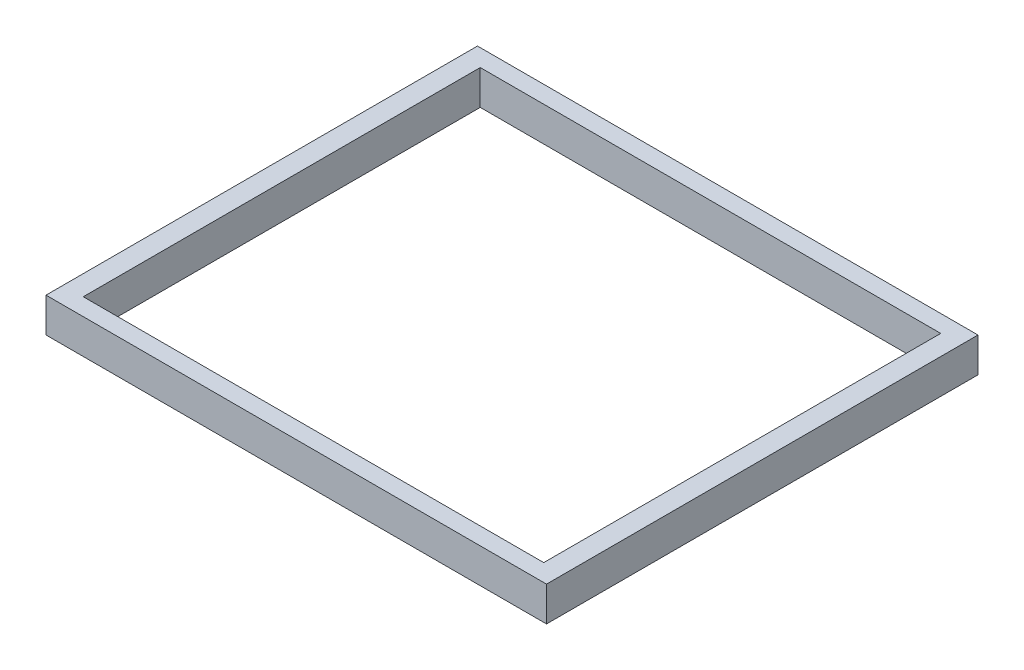
from build123d import *

# Parameters (mm, degrees)
SKETCH1_W           = 736.6
SKETCH1_H           = 635
SKETCH1_W_2         = 677.672
SKETCH1_H_2         = 584.2
BOSS_EXTRUDE2_DEPTH = 50.8


with BuildPart() as part:
    # Sketch1 → Boss-Extrude2 (new body)
    with BuildSketch(Plane(origin=(0, 0, 0), x_dir=(1, 0, 0), z_dir=(0, 1, 0))):
        Rectangle(SKETCH1_W, SKETCH1_H)
        Rectangle(SKETCH1_W_2, SKETCH1_H_2, mode=Mode.SUBTRACT)
    extrude(amount=BOSS_EXTRUDE2_DEPTH)


solid = part.part
